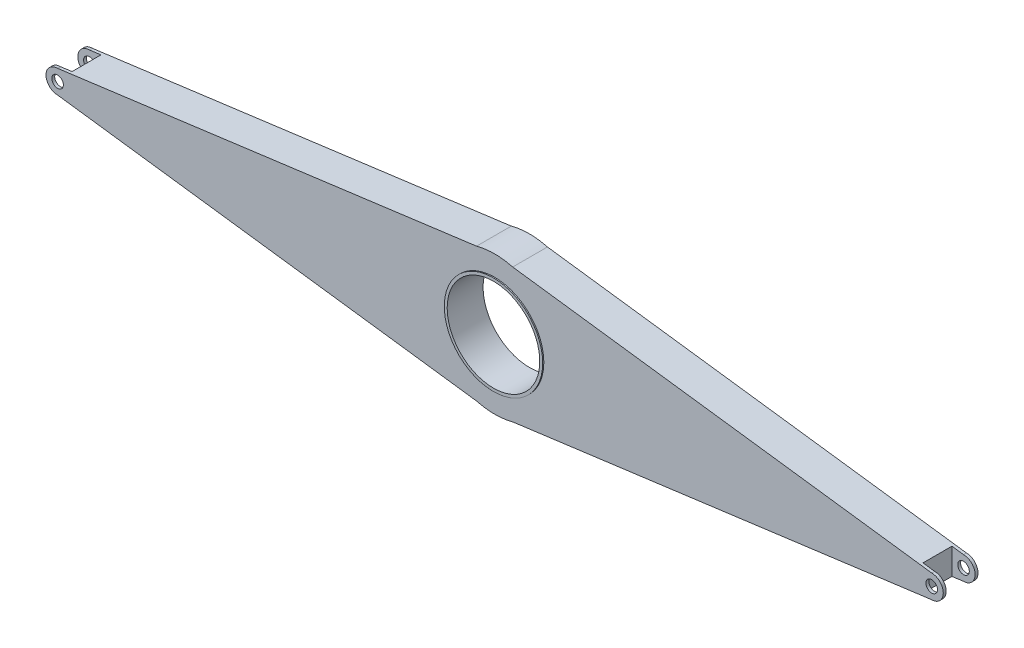
from build123d import *

# Parameters (mm, degrees)
SKETCH1_R           = 152.4
SKETCH1_R_2         = 101.6
BOSS_EXTRUDE1_DEPTH = 76.2
BOSS_EXTRUDE3_START = -76.2
BOSS_EXTRUDE3_DEPTH = 76.2
SKETCH7_R           = 12.7
CUT_EXTRUDE2_DEPTH  = 999.889514661
SKETCH8_W           = 63.5
SKETCH8_H           = 127
CUT_EXTRUDE3_DEPTH  = 50.8
SKETCH9_W           = 63.5
SKETCH9_H           = 127
CUT_EXTRUDE5_DEPTH  = 50.8
SKETCH11_R          = 107.95
SKETCH11_R_2        = 101.6
BOSS_EXTRUDE4_DEPTH = 2.54


with BuildPart() as part:
    # Sketch1 → Boss-Extrude1 (new body)
    with BuildSketch(Plane.XY):
        with Locations(Location((0, 0, 0), (0, 0, 180))):
            Circle(SKETCH1_R)
        with Locations(Location((0, 0, 0), (0, 0, 180))):
            Circle(SKETCH1_R_2, mode=Mode.SUBTRACT)
    extrude(amount=BOSS_EXTRUDE1_DEPTH)

    # Sketch2 → Boss-Extrude3 (add)
    with BuildSketch(Plane.XY.offset(76.2).offset(BOSS_EXTRUDE3_START)):
        with BuildLine():
            Line((-958.85, 25.4), (-39.674841602, 147.145054092))
            ThreePointArc((-39.674841602, 147.145054092), (-152.4, 0), (-39.674841602, -147.145054092))
            Line((-39.674841602, -147.145054092), (-958.85, -25.4))
            ThreePointArc((-958.85, -25.4), (-984.25, 0), (-958.85, 25.4))
        make_face()
        with BuildLine():
            Line((39.674841602, 147.145054092), (958.85, 25.4))
            ThreePointArc((958.85, 25.4), (984.25, 0), (958.85, -25.4))
            Line((958.85, -25.4), (39.674841602, -147.145054092))
            ThreePointArc((39.674841602, -147.145054092), (152.4, 0), (39.674841602, 147.145054092))
        make_face()
    extrude(amount=BOSS_EXTRUDE3_DEPTH)

    # Sketch7 → Cut-Extrude2 (cut, through all)
    with BuildSketch(Plane.XY.offset(76.2)):
        with Locations((-958.85, 0)):
            Circle(SKETCH7_R)
        with Locations((958.85, 0)):
            Circle(SKETCH7_R)
    extrude(amount=-CUT_EXTRUDE2_DEPTH, mode=Mode.SUBTRACT)

    # Sketch8 → Cut-Extrude3 (cut)
    with BuildSketch(Plane(origin=(984.25, 0, 0), x_dir=(0, 0, -1), z_dir=(1, 0, 0))):
        with Locations((-38.1, 0)):
            Rectangle(SKETCH8_W, SKETCH8_H)
    extrude(amount=-CUT_EXTRUDE3_DEPTH, mode=Mode.SUBTRACT)

    # Sketch9 → Cut-Extrude5 (cut)
    with BuildSketch(Plane(origin=(-984.25, 0, 0), x_dir=(0, 0, -1), z_dir=(1, 0, 0))):
        with Locations((-38.1, 0)):
            Rectangle(SKETCH9_W, SKETCH9_H)
    extrude(amount=CUT_EXTRUDE5_DEPTH, mode=Mode.SUBTRACT)

    # Sketch11 → Boss-Extrude4 (add)
    with BuildSketch(Plane.XY.offset(76.2)):
        Circle(SKETCH11_R)
        with Locations(Location((0, 0, 0), (0, 0, 180))):
            Circle(SKETCH11_R_2, mode=Mode.SUBTRACT)
    extrude(amount=BOSS_EXTRUDE4_DEPTH)


solid = part.part
